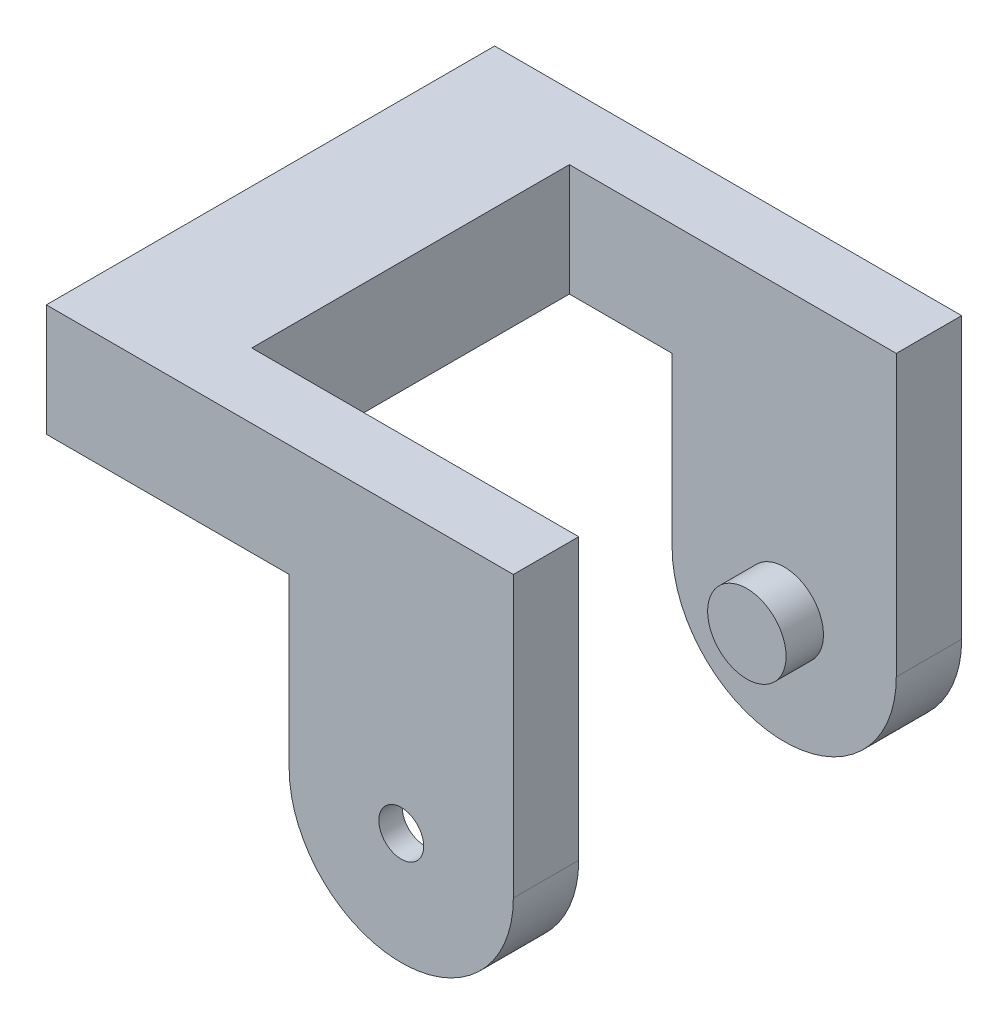
from build123d import *

# Parameters (mm, degrees)
SKETCH1_R           = 9.5
BOSS_EXTRUDE1_DEPTH = 48
SKETCH2_W           = 34
SKETCH2_H           = 30
CUT_EXTRUDE1_DEPTH  = 62.481704596
BOSS_EXTRUDE2_START = -2.5
SKETCH3_R           = 9.5
SKETCH3_R_2         = 2.4
BOSS_EXTRUDE2_DEPTH = 2.5
SKETCH4_R           = 9.5
SKETCH4_R_2         = 4.2
BOSS_EXTRUDE3_DEPTH = 7
SKETCH5_R           = 4.2
BOSS_EXTRUDE4_DEPTH = 11
BOSS_EXTRUDE5_DEPTH = 48
SKETCH7_R           = 2.4
CUT_EXTRUDE2_DEPTH  = 69.176242196
CUT_EXTRUDE3_START  = -4.5
SKETCH8_R           = 9.5
CUT_EXTRUDE3_DEPTH  = 4.5
SKETCH9_R           = 6.067807638
CUT_EXTRUDE4_DEPTH  = 4.5
SKETCH10_R          = 9.5
BOSS_EXTRUDE6_DEPTH = 4.5
SKETCH11_R          = 4.2
BOSS_EXTRUDE7_DEPTH = 4
SKETCH12_R          = 2.4
BOSS_EXTRUDE8_DEPTH = 2.5
SKETCH13_W          = 35
SKETCH13_H          = 34
CUT_EXTRUDE5_DEPTH  = 14.5


with BuildPart() as part:
    # Sketch1 → Boss-Extrude1 (new body)
    with BuildSketch(Plane.XY):
        with BuildLine():
            Line((-12, 0), (-12, 30))
            Line((-12, 30), (12, 30))
            Line((12, 30), (12, 0))
            ThreePointArc((12, 0), (0, -12), (-12, 0))
        make_face()
        Circle(SKETCH1_R, mode=Mode.SUBTRACT)
    extrude(amount=-BOSS_EXTRUDE1_DEPTH)

    # Sketch2 → Cut-Extrude1 (cut, through all)
    with BuildSketch(Plane.ZY.offset(12)):
        with Locations((-24, 3)):
            Rectangle(SKETCH2_W, SKETCH2_H)
    extrude(amount=-CUT_EXTRUDE1_DEPTH, mode=Mode.SUBTRACT)

    # Sketch3 → Boss-Extrude2 (add)
    with BuildSketch(Plane(origin=(0, 0, -48), x_dir=(-1, 0, 0), z_dir=(0, 0, -1)).offset(BOSS_EXTRUDE2_START)):
        Circle(SKETCH3_R)
        Circle(SKETCH3_R_2, mode=Mode.SUBTRACT)
    extrude(amount=BOSS_EXTRUDE2_DEPTH)

    # Sketch4 → Boss-Extrude3 (add)
    with BuildSketch(Plane.XY):
        with Locations(Location((0, 0, 0), (0, 0, 180))):
            Circle(SKETCH4_R)
        Circle(SKETCH4_R_2, mode=Mode.SUBTRACT)
    extrude(amount=-BOSS_EXTRUDE3_DEPTH)

    # Sketch5 → Boss-Extrude4 (add)
    with BuildSketch(Plane.XY):
        Circle(SKETCH5_R)
    extrude(amount=-BOSS_EXTRUDE4_DEPTH)

    # Sketch6 → Boss-Extrude5 (add)
    with BuildSketch(Plane(origin=(0, 0, -48), x_dir=(-1, 0, 0), z_dir=(0, 0, -1))):
        Polygon((12, 30), (12, 18), (18, 18), (38, 18), (38, 30), align=None)
    extrude(amount=-BOSS_EXTRUDE5_DEPTH)

    # Sketch7 → Cut-Extrude2 (cut, through all)
    with BuildSketch(Plane.XY):
        with Locations(Location((0, 0, 0), (0, 0, 180))):
            Circle(SKETCH7_R)
    extrude(amount=-CUT_EXTRUDE2_DEPTH, mode=Mode.SUBTRACT)

    # Sketch8 → Cut-Extrude3 (cut)
    with BuildSketch(Plane(origin=(0, 0, -7), x_dir=(-1, 0, 0), z_dir=(0, 0, -1)).offset(CUT_EXTRUDE3_START)):
        Circle(SKETCH8_R)
    extrude(amount=CUT_EXTRUDE3_DEPTH, mode=Mode.SUBTRACT)


with BuildPart() as cut_extrude3_piece_1:
    # of the separate pieces the step leaves, piece 1, a body of its own (cut_extrude3_pieces)
    add(part.part.solids().sort_by_distance((-12, 0, 0))[0])

    # Sketch10 → Boss-Extrude6 (add)
    with BuildSketch(Plane.XY.offset(-45.5)):
        with Locations(Location((0, 0, 0), (0, 0, 90))):
            Circle(SKETCH10_R)
    extrude(amount=BOSS_EXTRUDE6_DEPTH)

    # Sketch11 → Boss-Extrude7 (add)
    with BuildSketch(Plane.XY.offset(-41)):
        with Locations(Location((0, 0, 0), (0, 0, 180))):
            Circle(SKETCH11_R)
    extrude(amount=BOSS_EXTRUDE7_DEPTH)

    # Sketch12 → Boss-Extrude8 (add)
    with BuildSketch(Plane(origin=(0, 0, -48), x_dir=(-1, 0, 0), z_dir=(0, 0, -1))):
        with Locations(Location((0, 0, 0), (0, 0, 180))):
            Circle(SKETCH12_R)
    extrude(amount=-BOSS_EXTRUDE8_DEPTH)

    # Sketch13 → Cut-Extrude5 (cut)
    with BuildSketch(Plane(origin=(0, 30, 0), x_dir=(1, 0, 0), z_dir=(0, 1, 0))):
        with Locations((-5.5, 24)):
            Rectangle(SKETCH13_W, SKETCH13_H)
    extrude(amount=-CUT_EXTRUDE5_DEPTH, mode=Mode.SUBTRACT)


with BuildPart() as cut_extrude3_piece_2:
    # of the separate pieces the step leaves, piece 2, a body of its own (cut_extrude3_pieces)
    add(part.part.solids().sort_by_distance((4.2, 0, -7))[0])

    # Sketch9 → Cut-Extrude4 (cut)
    with BuildSketch(Plane(origin=(0, 0, -11), x_dir=(-1, 0, 0), z_dir=(0, 0, -1))):
        Circle(SKETCH9_R)
    extrude(amount=-CUT_EXTRUDE4_DEPTH, mode=Mode.SUBTRACT)


solid = cut_extrude3_piece_1.part
